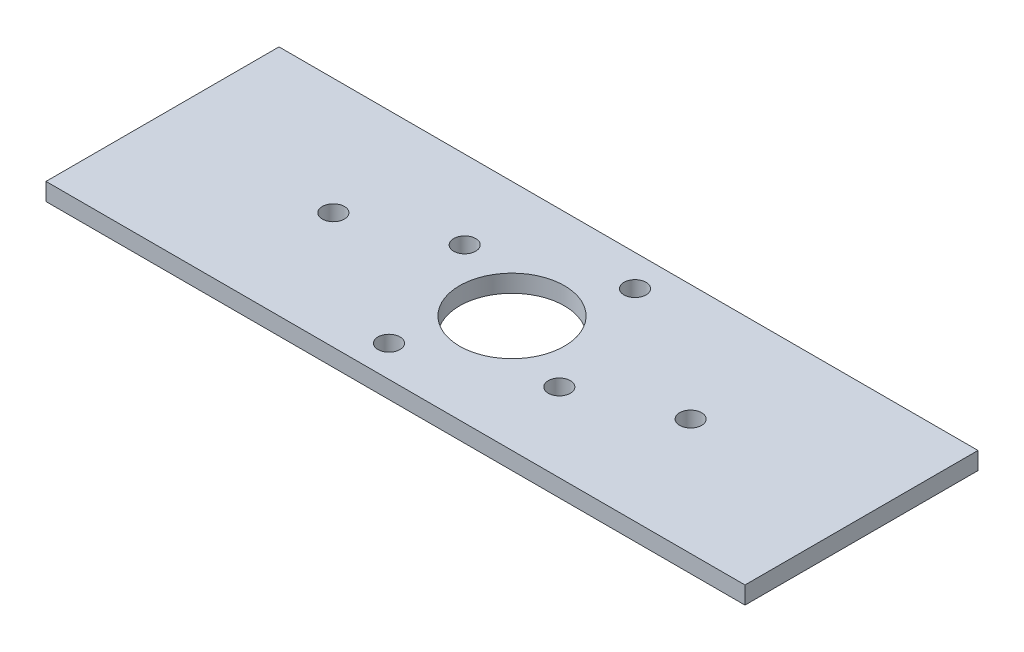
from build123d import *

# Parameters (mm, degrees)
SKETCH1_W                = 190.5
SKETCH1_H                = 63.5
BOSS_EXTRUDE1_DEPTH      = 4.7625
SKETCH3_R                = 14.2875
CUT_EXTRUDE1_DEPTH       = 101.515204851
F_6_0_6_DIAMETER_HOLE1_D = 6


with BuildPart() as part:
    # Sketch1 → Boss-Extrude1 (new body)
    with BuildSketch(Plane(origin=(0, 0, 0), x_dir=(1, 0, 0), z_dir=(0, 1, 0))):
        Rectangle(SKETCH1_W, SKETCH1_H)
    extrude(amount=BOSS_EXTRUDE1_DEPTH)

    # Sketch3 → Cut-Extrude1 (cut, through all)
    with BuildSketch(Plane(origin=(0, 4.7625, 0), x_dir=(1, 0, 0), z_dir=(0, 1, 0))):
        with Locations(Location((0, 0, 0), (0, 0, 270))):
            Circle(SKETCH3_R)
    extrude(amount=-CUT_EXTRUDE1_DEPTH, mode=Mode.SUBTRACT)

    # Ø6.0 (6) Diameter Hole1 (through all)
    with Locations(Plane(origin=(0, 4.7625, 0), x_dir=(1, 0, 0), z_dir=(0, 1, 0))):
        with Locations((-23.209797391, 10.318202609), (-10.318202609, -23.209797391), (10.318202609, 23.209797391), (23.209797391, -10.318202609), (-48.683333333, 0), (48.683333333, 0)):
            Hole(F_6_0_6_DIAMETER_HOLE1_D / 2)


solid = part.part
